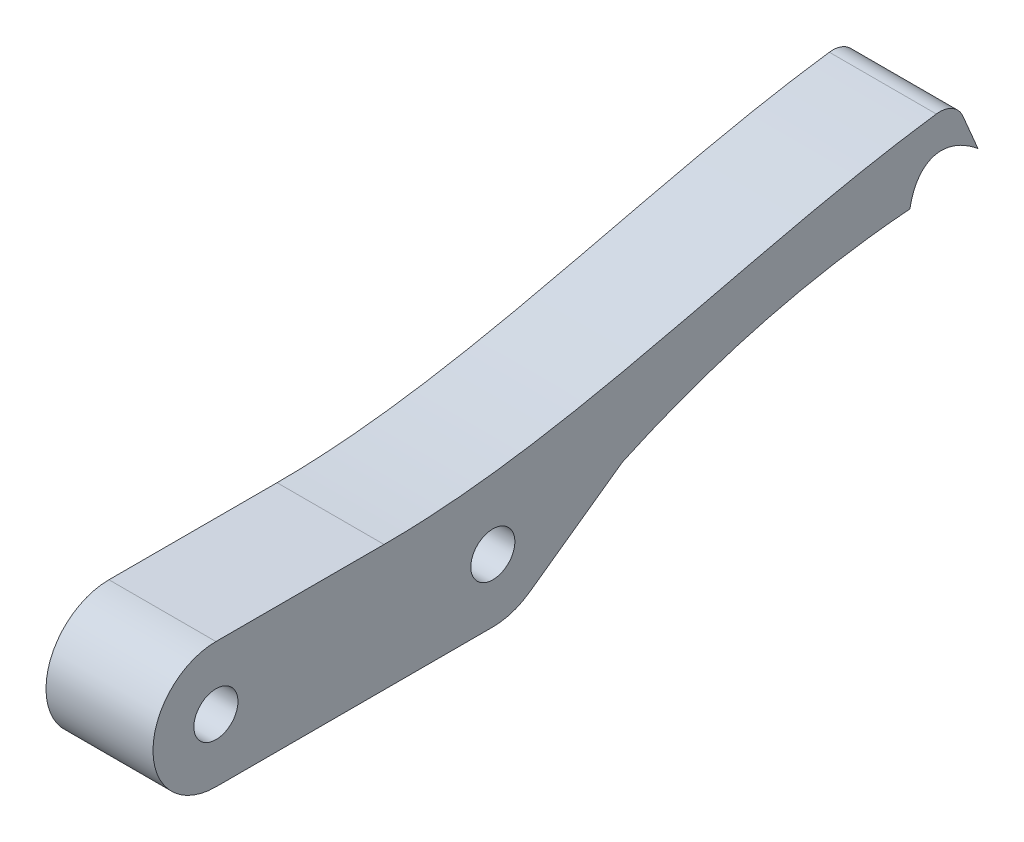
from build123d import *

# Parameters (mm, degrees)
SKETCH1_R           = 1.7499999999999998
SKETCH1_R_2         = 1.7500000000000002
BOSS_EXTRUDE1_DEPTH = 8.5
BOSS_EXTRUDE2_START = -8.5
BOSS_EXTRUDE2_DEPTH = 8.5
FILLET1_R           = 2


with BuildPart() as part:
    # Sketch1 → Boss-Extrude1 (new body)
    with BuildSketch(Plane(origin=(0, 0, 0), x_dir=(0, 0, -1), z_dir=(1, 0, 0))):
        with BuildLine():
            Line((27, 10), (4.999999999999845, 10))
            ThreePointArc((4.999999999999845, 9.999999999999996), (2.66e-15, 4.999999999999989), (4.999999999999866, 2.66e-15))
            Line((4.999999999999866, 0), (27, 0))
            ThreePointArc((27, -8.9e-16), (32, 5), (27, 10))
        make_face()
        with Locations((5, 5)):
            Circle(SKETCH1_R, mode=Mode.SUBTRACT)
        with Locations((27, 5)):
            Circle(SKETCH1_R_2, mode=Mode.SUBTRACT)
    extrude(amount=BOSS_EXTRUDE1_DEPTH)

    # Sketch2 → Boss-Extrude2 (add)
    with BuildSketch(Plane(origin=(8.5, 0, 0), x_dir=(0, 0, -1), z_dir=(1, 0, 0)).offset(BOSS_EXTRUDE2_START)):
        with BuildLine():
            add(Edge.make_bspline(
                [(63.753003749139694, 17.8724364513696), (48.4484123726985, 16.075931173157382), (33.927648133343, 10.00000000000011), (18.35740593050513, 10)],
                knots=[0, 0, 0, 0, 1, 1, 1, 1], degree=3))
            Line((18.35740593050513, 10), (27, 10.000000000000002))
            ThreePointArc((27, 10.000000000000004), (31.76198872224619, 6.524291116945876), (29.90346284332652, 0.9293853636800407))
            Line((29.903462843326523, 0.9293853636800362), (37.27788733358429, 6.189369275529155))
            add(Edge.make_bspline(
                [(37.27788733358429, 6.189369275529155), (48.425576395597574, 11.344056029156562), (60.710162222104955, 12.2385110488325)],
                knots=[0, 0, 0, 1, 1, 1], degree=2))
            Line((60.710162222104955, 12.238511048832498), (65.58908690842728, 13.539967250903384))
            Line((65.58908690842728, 13.539967250903384), (63.753003749139694, 17.8724364513696))
        make_face()
    extrude(amount=BOSS_EXTRUDE2_DEPTH)

    # Sketch3 → Cut-Revolve1 (revolve, cut)
    with BuildSketch(Plane.ZY.offset(-4.25)):
        with BuildLine():
            Line((-61.363286830934264, 3.0092373204057665), (-70.57054843387056, 6.911330832239489))
            add(Edge.make_bspline(
                [(-61.363286830934264, 3.0092373204057665), (-56.87587929232551, 13.597588163782518), (-61.47951009379365, 15.548634919699378), (-66.08314089526179, 17.499681675616234), (-70.57054843387056, 6.911330832239489)],
                knots=[1.5707963267948968, 1.5707963267948968, 1.5707963267948968, 3.141592653589793, 3.141592653589793, 4.71238898038469, 4.71238898038469, 4.71238898038469], degree=2, weights=[1, 0.7071067811865477, 1, 0.7071067811865477, 1]))
        make_face()
    revolve(axis=Axis((4.25, 3.0092373204057665, -61.363286830934264), (0, 0.3902093511833724, -0.9207261602936302)), mode=Mode.SUBTRACT)

    # Fillet1
    fillet1_edges = [part.edges().sort_by_distance(p)[0] for p in [
        (4.25, 17.8724364513696, -63.753003749139694),
    ]]
    fillet(fillet1_edges, radius=FILLET1_R)

    # Sketch4 → Cut-Revolve4 (revolve, cut)
    with BuildSketch(Plane(origin=(0, 24.455596913653128, -57.70468538416743), x_dir=(0, -0.9207261602936302, -0.39020935118337224), z_dir=(0, 0.39020935118337224, -0.9207261602936302))):
        with BuildLine():
            Line((21.173844817348538, 0.7500000000000007), (21.173844817348538, -9.250000000000004))
            add(Edge.make_bspline(
                [(21.173844817348538, 0.7500000000000007), (9.67384481734854, 0.7500000000000027), (9.673844817348536, -4.249999999999997), (9.673844817348535, -9.249999999999996), (21.173844817348538, -9.250000000000004)],
                knots=[4.71238898038469, 4.71238898038469, 4.71238898038469, 6.283185307179586, 6.283185307179586, 7.853981633974483, 7.853981633974483, 7.853981633974483], degree=2, weights=[1, 0.7071067811865476, 1, 0.7071067811865476, 1]))
        make_face()
    revolve(axis=Axis((-0.7500000000000007, 4.960284076322628, -65.96691763240241), (1, 0, 0)), mode=Mode.SUBTRACT)


solid = part.part
